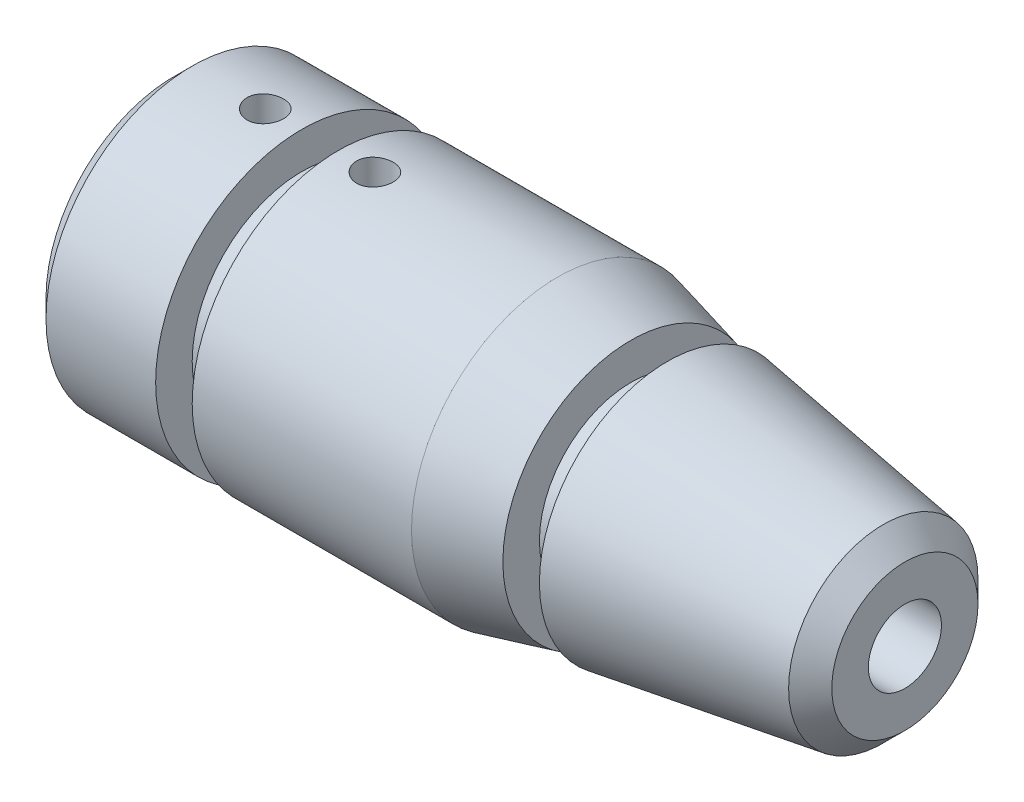
from build123d import *
from OCP.BRepFilletAPI import BRepFilletAPI_MakeChamfer

# Parameters (mm, degrees)
CHAMFER1_SIZE           = 1.5875
CHAMFER1_SIZE2          = 1.898209315
CUT_EXTRUDE1_REACH      = 71.561
CUT_EXTRUDE1_END_RADIUS = 6.35
SKETCH2_R               = 1.5875


with BuildPart() as part:
    # Sketch1 → Revolve1 (revolve)
    with BuildSketch(Plane.XY, mode=Mode.PRIVATE) as revolve1_sk:
        Polygon((0, 6.35), (0, 12.7), (11.1125, 12.7), (11.1125, 9.525), (14.2875, 9.525), (14.2875, 12.7), (33.3375, 12.7), (39.6875, 11.1125), (39.6875, 7.9375), (42.8625, 7.9375), (42.8625, 11.1125), (63.5, 7.9375), (63.5, 3.175), (25.4, 3.175), (20.6375, 6.35), align=None)
    revolve(revolve1_sk.sketch.rotate(Axis((0, 0, 0), (1, 0, 0)), 90), axis=Axis((0, 0, 0), (1, 0, 0)))

    # Chamfer1: one chamfer whose edges measure the first distance from different faces: ONE call of the kernel's chamfer builder (chamfer() names one face for all edges)
    chamfer1_edges_1 = [part.edges().sort_by_distance(p)[0] for p in [
        (0, 0, -12.7),
    ]]
    chamfer1_edges_2 = [part.edges().sort_by_distance(p)[0] for p in [
        (63.5, 0, -7.9375),
    ]]
    chamfer1_side_2 = [part.faces().sort_by_distance(p)[0] for p in [
        (63.5, 0, -7.712993597),
    ]]
    chamfer1 = BRepFilletAPI_MakeChamfer(part.part.solid().wrapped)
    for e in chamfer1_edges_1:
        chamfer1.Add(CHAMFER1_SIZE, e.wrapped)
    for e in chamfer1_edges_2:
        chamfer1.Add(CHAMFER1_SIZE, CHAMFER1_SIZE2, e.wrapped, chamfer1_side_2[0].wrapped)  # the first distance lies on this face
    add(Compound.cast(chamfer1.Shape()), mode=Mode.REPLACE)

    # Cut-Extrude1: up to this cylinder (the profile starts outside it)
    cut_extrude1_end = Plane(origin=(12.7, 0, 0), z_dir=(-1, 0, 0)) * Cylinder(CUT_EXTRUDE1_END_RADIUS, 166.347, mode=Mode.PRIVATE)
    # Sketch2 → Cut-Extrude1 (cut, up to the surface)
    with BuildSketch(Plane(origin=(0, 12.7, 0), x_dir=(1, 0, 0), z_dir=(0, 1, 0)), mode=Mode.PRIVATE) as cut_extrude1_sk1:
        with Locations(Location((7.9375, 0, 0), (0, 0, 270))):
            Circle(SKETCH2_R)
    cut_extrude1_tool1 = extrude(cut_extrude1_sk1.sketch, amount=-CUT_EXTRUDE1_REACH, mode=Mode.PRIVATE) - cut_extrude1_end
    add(cut_extrude1_tool1.solids().sort_by_distance((7.9375, 12.7, 0))[0], mode=Mode.SUBTRACT)
    # Sketch2 → Cut-Extrude1 (cut, up to the surface)
    with BuildSketch(Plane(origin=(0, 12.7, 0), x_dir=(1, 0, 0), z_dir=(0, 1, 0)), mode=Mode.PRIVATE) as cut_extrude1_sk2:
        with Locations(Location((17.4625, 0, 0), (0, 0, 270))):
            Circle(SKETCH2_R)
    cut_extrude1_tool2 = extrude(cut_extrude1_sk2.sketch, amount=-CUT_EXTRUDE1_REACH, mode=Mode.PRIVATE) - cut_extrude1_end
    add(cut_extrude1_tool2.solids().sort_by_distance((17.4625, 12.7, 0))[0], mode=Mode.SUBTRACT)


solid = part.part
